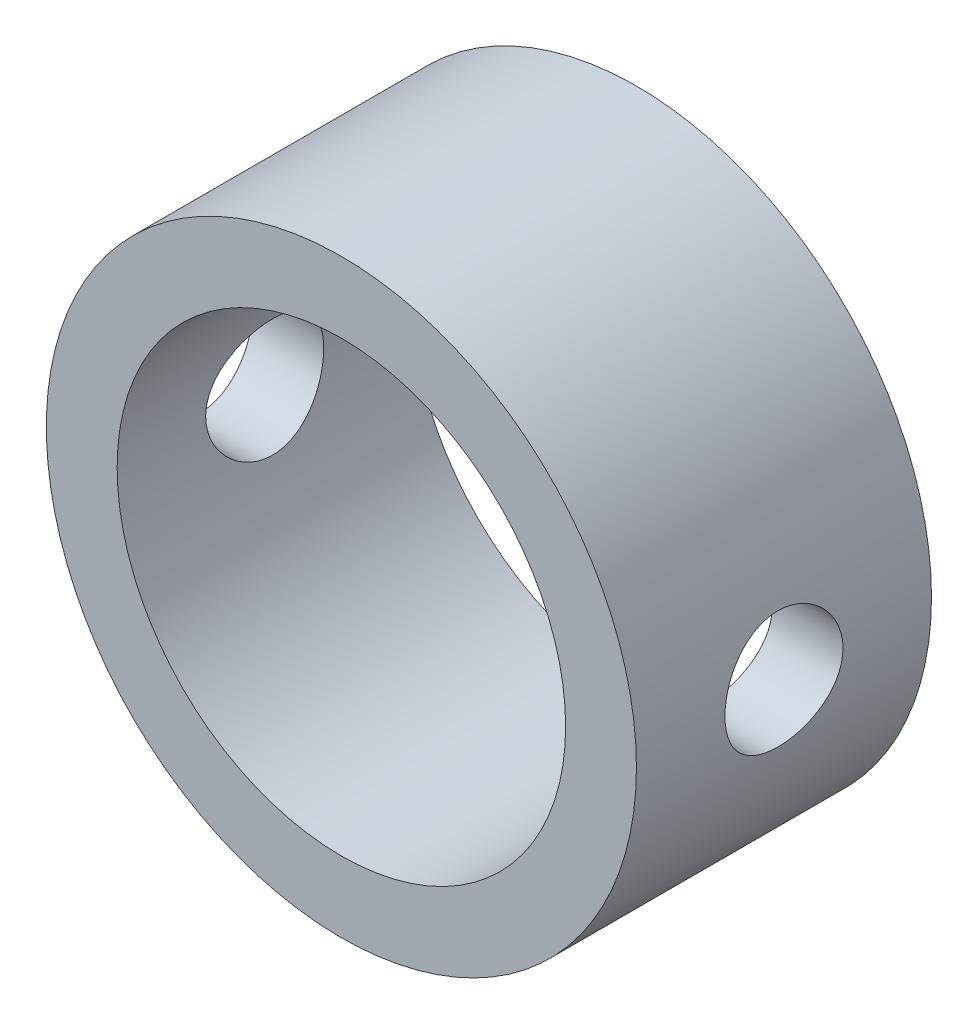
from build123d import *

# Parameters (mm, degrees)
ESBO_O1_R                  = 10
ESBO_O1_R_2                = 7.6
RESSALTO_EXTRUS_O1_DEPTH   = 10
CORTE_EXTRUS_O1_DEPTH      = 18.320508076
CORTE_EXTRUS_O1_DEPTH_BACK = 18.320508076
ESBO_O2_R                  = 2


with BuildPart() as part:
    # Esboço1 → Ressalto-extrusão1 (new body)
    with BuildSketch(Plane.XY):
        Circle(ESBO_O1_R)
        Circle(ESBO_O1_R_2, mode=Mode.SUBTRACT)
    extrude(amount=RESSALTO_EXTRUS_O1_DEPTH)

    # Esboço2 → Corte-extrusão1 (cut, two sides: drawn at the far end of the back side and taken through both)
    with BuildSketch(Plane(origin=(0, 0, 0), x_dir=(0, 0, -1), z_dir=(1, 0, 0)).offset(-CORTE_EXTRUS_O1_DEPTH_BACK)):
        with Locations((-5, 0)):
            Circle(ESBO_O2_R)
    extrude(amount=CORTE_EXTRUS_O1_DEPTH + CORTE_EXTRUS_O1_DEPTH_BACK, mode=Mode.SUBTRACT)


solid = part.part
